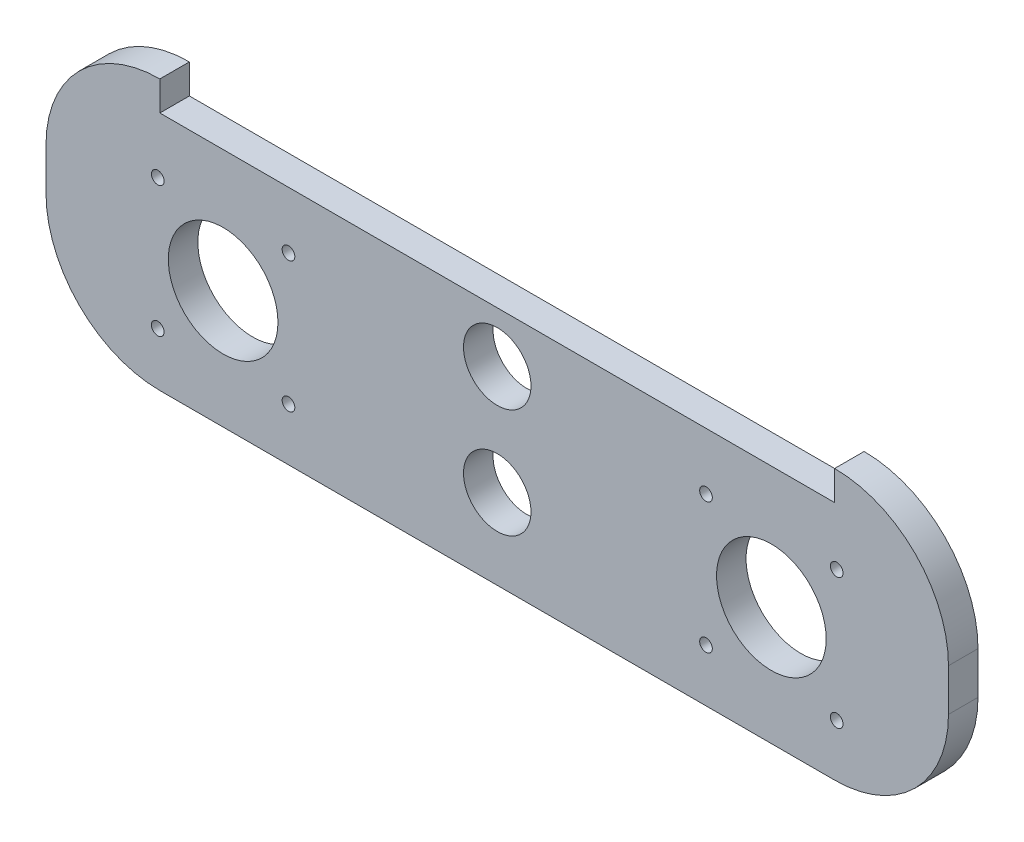
from build123d import *

# Parameters (mm, degrees)
SCHIZZO1_R                   = 13
SCHIZZO1_R_2                 = 1.5
SCHIZZO1_R_3                 = 8
ESTRUSIONE_ESTRUSIONE1_DEPTH = 7


with BuildPart() as part:
    # Schizzo1 → Estrusione-Estrusione1 (new body)
    with BuildSketch(Plane.XY):
        with BuildLine():
            Line((-80, 32), (-80, 25))
            Line((-80, 25), (80, 25))
            Line((80, 25), (80, 32))
            ThreePointArc((80, 32), (99.091883092, 24.091883092), (107, 5))
            Line((107, 5), (107, -5))
            ThreePointArc((107, -5), (99.091883092, -24.091883092), (80, -32))
            Line((80, -32), (-80, -32))
            ThreePointArc((-80, -32), (-99.091883092, -24.091883092), (-107, -5))
            Line((-107, -5), (-107, 5))
            ThreePointArc((-107, 5), (-99.091883092, 24.091883092), (-80, 32))
        make_face()
        with Locations((-65, -4.000219356)):
            Circle(SCHIZZO1_R, mode=Mode.SUBTRACT)
        with Locations((-80.499780644, 11.499561287)):
            Circle(SCHIZZO1_R_2, mode=Mode.SUBTRACT)
        with Locations((-80.499780644, -19.5)):
            Circle(SCHIZZO1_R_2, mode=Mode.SUBTRACT)
        with Locations((-49.500219356, -19.5)):
            Circle(SCHIZZO1_R_2, mode=Mode.SUBTRACT)
        with Locations((-49.500219356, 11.499561287)):
            Circle(SCHIZZO1_R_2, mode=Mode.SUBTRACT)
        with Locations((65, -4.000219356)):
            Circle(SCHIZZO1_R, mode=Mode.SUBTRACT)
        with Locations((49.500219356, -19.5)):
            Circle(SCHIZZO1_R_2, mode=Mode.SUBTRACT)
        with Locations((80.499780644, -19.5)):
            Circle(SCHIZZO1_R_2, mode=Mode.SUBTRACT)
        with Locations((80.499780644, 11.499561287)):
            Circle(SCHIZZO1_R_2, mode=Mode.SUBTRACT)
        with Locations((49.500219356, 11.499561287)):
            Circle(SCHIZZO1_R_2, mode=Mode.SUBTRACT)
        with Locations((0, 12.9413)):
            Circle(SCHIZZO1_R_3, mode=Mode.SUBTRACT)
        with Locations((0, -12.9413)):
            Circle(SCHIZZO1_R_3, mode=Mode.SUBTRACT)
    extrude(amount=ESTRUSIONE_ESTRUSIONE1_DEPTH)


solid = part.part
